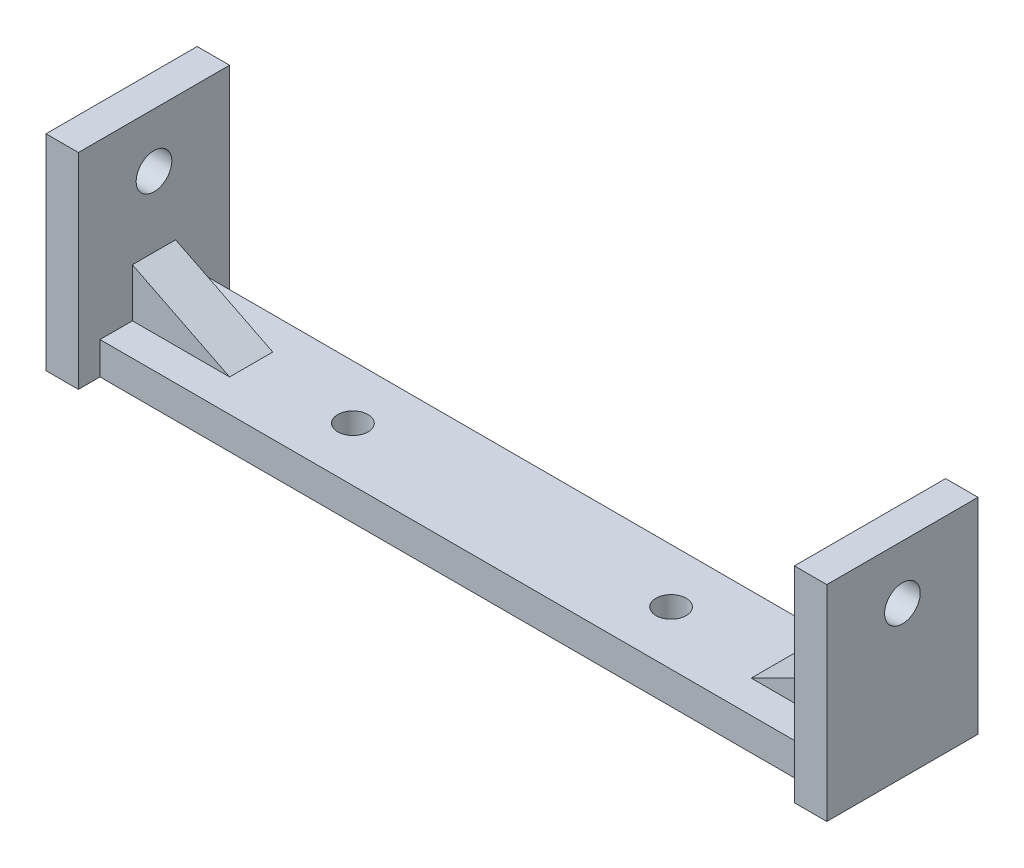
from build123d import *

# Parameters (mm, degrees)
SKETCH_1_W           = 72.3
SKETCH_1_H           = 10
SKETCH_1_R           = 1.4
EXTRUDE_1_DEPTH      = 3
SKETCH_2_W           = 3
SKETCH_2_H           = 14
EXTRUDE_2_DEPTH      = 19
CUT_EXTRUDE_1_REACH  = 77.082
SKETCH_3_R           = 1.65
EXTRUDE_3_DEPTH      = 2
EXTRUDE_3_DEPTH_BACK = 2


with BuildPart() as part:
    # 草图1 → 凸台-拉伸1 (new body)
    with BuildSketch(Plane(origin=(0, 0, 0), x_dir=(1, 0, 0), z_dir=(0, 1, 0))):
        Rectangle(SKETCH_1_W, SKETCH_1_H)
        with Locations(Location((-14.73, 0, 0), (0, 0, 270))):
            Circle(SKETCH_1_R, mode=Mode.SUBTRACT)
        with Locations(Location((14.73, 0, 0), (0, 0, 270))):
            Circle(SKETCH_1_R, mode=Mode.SUBTRACT)
    extrude(amount=EXTRUDE_1_DEPTH)

    # 草图2 → 凸台-拉伸2 (add)
    with BuildSketch(Plane(origin=(0, 0, 0), x_dir=(1, 0, 0), z_dir=(0, 1, 0))):
        with Locations((-34.65, 0)):
            Rectangle(SKETCH_2_W, SKETCH_2_H)
        with Locations((34.65, 0)):
            Rectangle(SKETCH_2_W, SKETCH_2_H)
    extrude(amount=EXTRUDE_2_DEPTH)

    # 切除-拉伸1: up to this face of the body (flat: up to its plane)
    cut_extrude_1_end = Plane(part.part.faces().sort_by_distance((36.15, 9.5, 0))[0])
    # 草图3 → 切除-拉伸1 (cut, up to the picked face)
    with BuildSketch(Plane.ZY.offset(36.15), mode=Mode.PRIVATE) as cut_extrude_1_sk1:
        with Locations((0, 14)):
            Circle(SKETCH_3_R)
    cut_extrude_1_tool1 = split(extrude(cut_extrude_1_sk1.sketch, amount=-CUT_EXTRUDE_1_REACH, mode=Mode.PRIVATE), bisect_by=cut_extrude_1_end, keep=Keep.BOTH, mode=Mode.PRIVATE)
    add(cut_extrude_1_tool1.solids().sort_by(Axis((-36.15, 14, 0), (1, 0, 0)))[0], mode=Mode.SUBTRACT)

    # 草图4 → 凸台-拉伸3 (add, two sides: drawn at the far end of the back side and taken through both)
    with BuildSketch(Plane.XY.offset(-EXTRUDE_3_DEPTH_BACK)):
        Polygon((-36.15, 9), (-24.15, 3), (-36.15, 3), align=None)
        Polygon((36.15, 9), (24.15, 3), (36.15, 3), align=None)
    extrude(amount=EXTRUDE_3_DEPTH + EXTRUDE_3_DEPTH_BACK)


solid = part.part
